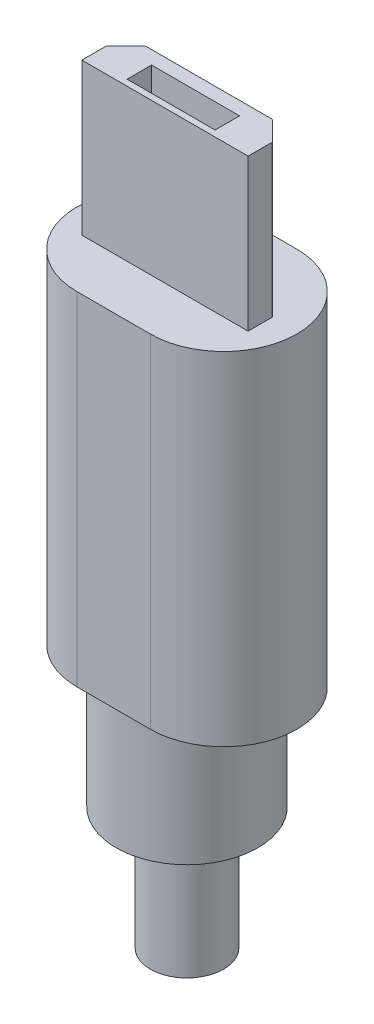
from build123d import *

# Parameters (mm, degrees)
EXTRUDE_1_DEPTH     = 14
SKETCH_2_R          = 2.9
EXTRUDE_2_DEPTH     = 5
EXTRUDE_3_DEPTH     = 6.2
SKETCH_5_W          = 3.6
SKETCH_5_H          = 1
CUT_EXTRUDE_1_DEPTH = 4
FILLET_1_R          = 0.1
SKETCH_6_R          = 1.5
EXTRUDE_4_DEPTH     = 5
CUT_EXTRUDE_2_DEPTH = 0.1


with BuildPart() as part:
    # 草图1 → 凸台-拉伸1 (new body)
    with BuildSketch(Plane(origin=(0, 0, 0), x_dir=(1, 0, 0), z_dir=(0, 1, 0))):
        with BuildLine():
            Line((-1.5, 3), (1.5, 3))
            ThreePointArc((1.5, 3), (4.5, 0), (1.5, -3))
            Line((1.5, -3), (-1.5, -3))
            ThreePointArc((-1.5, -3), (-4.5, 0), (-1.5, 3))
        make_face()
    extrude(amount=EXTRUDE_1_DEPTH)

    # 草图2 → 凸台-拉伸2 (add)
    with BuildSketch(Plane.XZ):
        with Locations(Location((0, 0, 0), (0, 0, 270))):
            Circle(SKETCH_2_R)
    extrude(amount=EXTRUDE_2_DEPTH)

    # 草图3 → 凸台-拉伸3 (add)
    with BuildSketch(Plane(origin=(0, 14, 0), x_dir=(1, 0, 0), z_dir=(0, 1, 0))):
        Polygon((-3.4, 0.1), (-2.6, 0.9), (2.6, 0.9), (3.4, 0.1), (3.4, -0.9), (-3.4, -0.9), align=None)
    extrude(amount=EXTRUDE_3_DEPTH)

    # 草图5 → 切除-拉伸1 (cut)
    with BuildSketch(Plane(origin=(0, 20.2, 0), x_dir=(1, 0, 0), z_dir=(0, 1, 0))):
        with Locations((0, -0.15)):
            Rectangle(SKETCH_5_W, SKETCH_5_H)
    extrude(amount=-CUT_EXTRUDE_1_DEPTH, mode=Mode.SUBTRACT)

    # 圆角1
    fillet_1_edges = [part.edges().sort_by_distance(p)[0] for p in [
        (3.4, 17.1, -0.1),
        (2.6, 17.1, -0.9),
        (-2.6, 17.1, -0.9),
        (-3.4, 17.1, -0.1),
    ]]
    fillet(fillet_1_edges, radius=FILLET_1_R)

    # 草图6 → 凸台-拉伸4 (add)
    with BuildSketch(Plane.XZ.offset(5)):
        with Locations(Location((0, 0, 0), (0, 0, 270))):
            Circle(SKETCH_6_R)
    extrude(amount=EXTRUDE_4_DEPTH)

    # 草图8 → 切除-拉伸2 (cut)
    with BuildSketch(Plane(origin=(0, 0, -3), x_dir=(-1, 0, 0), z_dir=(0, 0, -1))):
        with BuildLine():
            Line((0, 11.52960021), (-0.716956191, 10.8097184))
            Line((-0.716956191, 10.8097184), (-0.127, 10.8097184))
            Line((-0.127, 10.8097184), (-0.127, 5.401898496))
            ThreePointArc((-0.127, 5.401898496), (-0.156162493, 5.355937009), (-0.21016765, 5.362745269))
            Line((-0.21016765, 5.362745269), (-1.120514747, 6.115321688))
            ThreePointArc((-1.120514747, 6.115321688), (-1.324422308, 6.378057505), (-1.397, 6.702620106))
            Line((-1.397, 6.702620106), (-1.397, 7.963089706))
            ThreePointArc((-1.397, 7.963089706), (-1.524, 8.962958591), (-1.651, 7.963089706))
            Line((-1.651, 7.963089706), (-1.651, 6.722530894))
            ThreePointArc((-1.651, 6.722530894), (-1.550201428, 6.271766401), (-1.267007097, 5.906869222))
            Line((-1.267007097, 5.906869222), (-0.219161751, 5.040624136))
            ThreePointArc((-0.219161751, 5.040624136), (-0.151192564, 4.953045531), (-0.127, 4.844857997))
            Line((-0.127, 4.844857997), (-0.127, 3.56953501))
            ThreePointArc((-0.127, 3.56953501), (0, 2.312364615), (0.127, 3.56953501))
            Line((0.127, 3.56953501), (0.127, 5.933535284))
            ThreePointArc((0.127, 5.933535284), (0.139930568, 6.013544838), (0.177405738, 6.08540818))
            Line((0.177405738, 6.08540818), (1.053118903, 7.259351528))
            ThreePointArc((1.053118903, 7.259351528), (1.165544414, 7.474941553), (1.204336117, 7.714970215))
            Line((1.204336117, 7.714970215), (1.204336117, 8.518458591))
            Line((1.204336117, 8.518458591), (1.524, 8.518458591))
            Line((1.524, 8.518458591), (1.524, 9.407458591))
            Line((1.524, 9.407458591), (0.635, 9.407458591))
            Line((0.635, 9.407458591), (0.635, 8.518458591))
            Line((0.635, 8.518458591), (0.954663883, 8.518458591))
            Line((0.954663883, 8.518458591), (0.954663883, 7.798383163))
            ThreePointArc((0.954663883, 7.798383163), (0.915872181, 7.558354501), (0.80344667, 7.342764476))
            Line((0.80344667, 7.342764476), (0.218518852, 6.558635439))
            ThreePointArc((0.218518852, 6.558635439), (0.161798089, 6.540796132), (0.127, 6.589010019))
            Line((0.127, 6.589010019), (0.127, 10.8097184))
            Line((0.127, 10.8097184), (0.716956191, 10.8097184))
            Line((0.716956191, 10.8097184), (0, 11.52960021))
        make_face()
    extrude(amount=-CUT_EXTRUDE_2_DEPTH, mode=Mode.SUBTRACT)


solid = part.part
